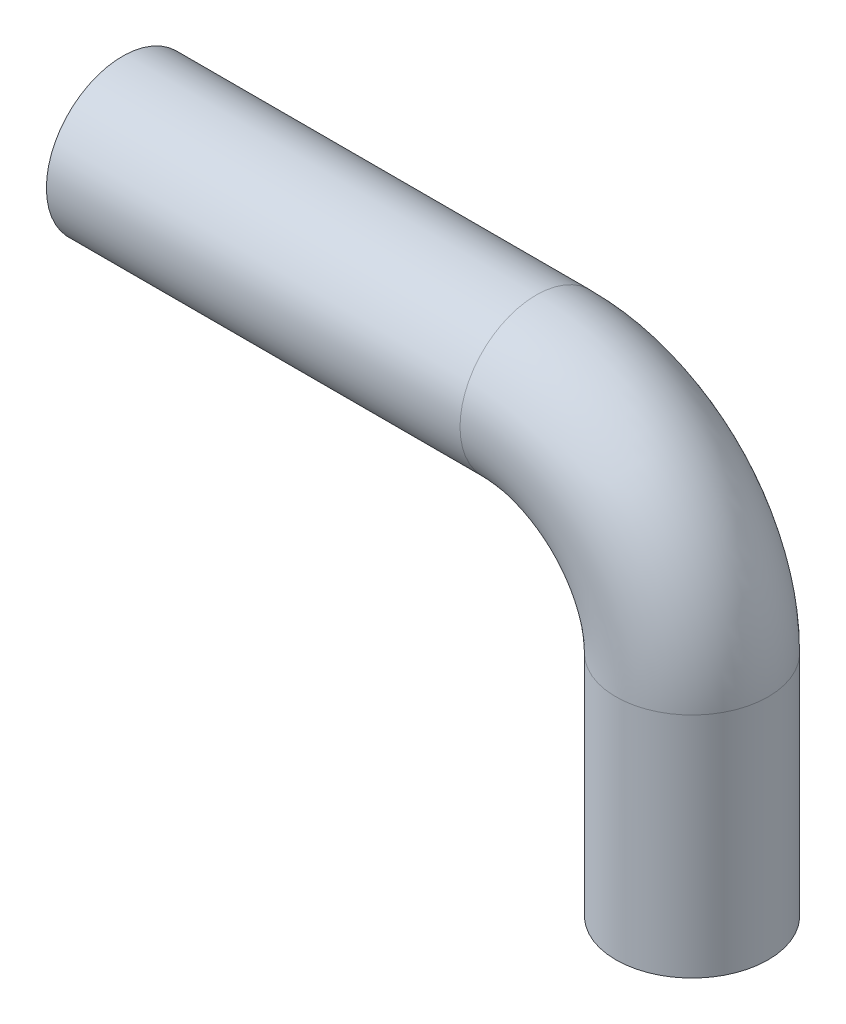
from build123d import *

# Parameters (mm, degrees)
CROQUIS1_R              = 12.7
SALIENTE_EXTRUIR1_DEPTH = 10
CROQUIS2_R              = 12.7


with BuildPart() as part:
    # Croquis1 → Saliente-Extruir1 (new body)
    with BuildSketch(Plane(origin=(0, 0, 0), x_dir=(1, 0, 0), z_dir=(0, 1, 0))):
        with Locations(Location((0, 0, 0), (0, 0, 270))):
            Circle(CROQUIS1_R)
    extrude(amount=SALIENTE_EXTRUIR1_DEPTH)

    # Barrer1: sweep along a curve in space
    with BuildLine() as barrer1_path:
        Line((0, 10, 0), (0, 38, 0))
        ThreePointArc((0, 38, 0), (-7.615223689, 56.384776311, 0), (-26, 64, 0))
        Line((-26, 64, 0), (-95, 64, 0))
    # Croquis2 → Barrer1 (sweep)
    with BuildSketch(Plane(origin=(0, 10, 0), x_dir=(1, 0, 0), z_dir=(0, 1, 0))):
        Circle(CROQUIS2_R)
    sweep(path=barrer1_path.line)


solid = part.part
